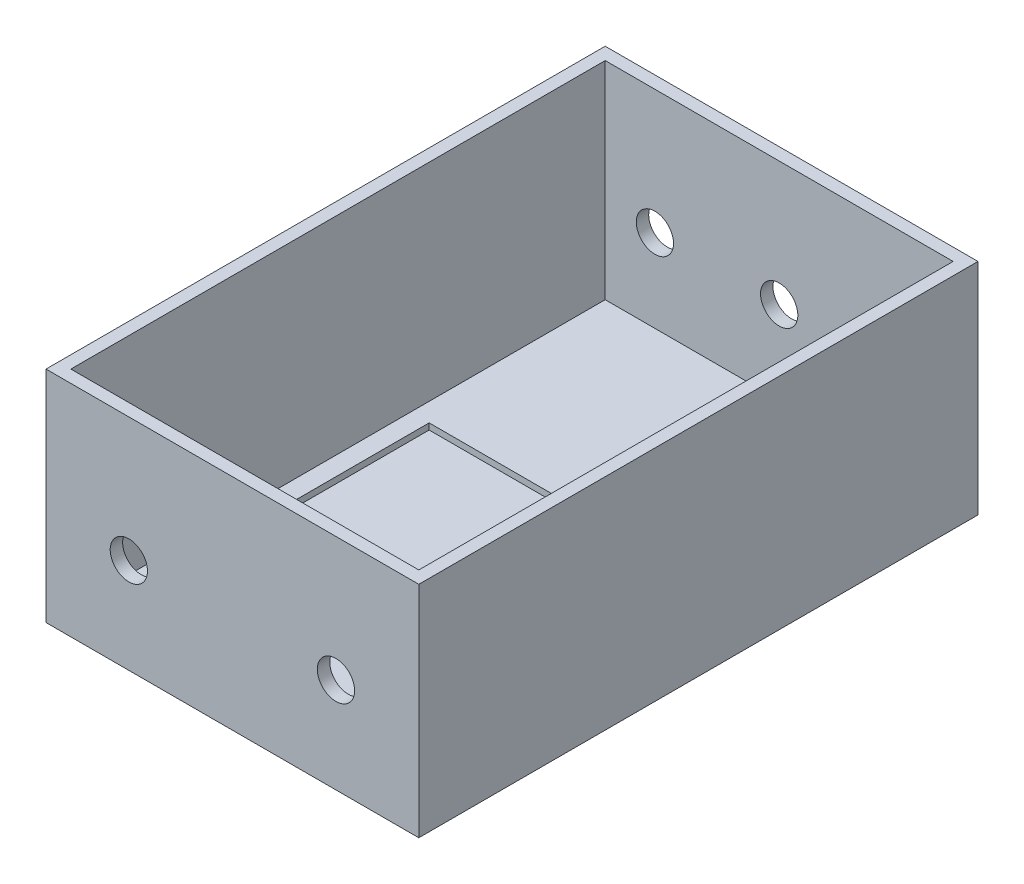
from build123d import *

# Parameters (mm, degrees)
SKETCH1_W           = 90
SKETCH1_H           = 135
BOSS_EXTRUDE1_DEPTH = 3
SKETCH2_W           = 75
SKETCH2_H           = 35
CUT_EXTRUDE1_DEPTH  = 1.5
SKETCH3_W           = 90
SKETCH3_H           = 135
SKETCH3_W_2         = 84
SKETCH3_H_2         = 129
BOSS_EXTRUDE2_DEPTH = 50
SKETCH4_R           = 4.5
CUT_EXTRUDE2_DEPTH  = 3
SKETCH5_R           = 4.5
CUT_EXTRUDE3_DEPTH  = 3


with BuildPart() as part:
    # Sketch1 → Boss-Extrude1 (new body)
    with BuildSketch(Plane(origin=(0, 0, 0), x_dir=(1, 0, 0), z_dir=(0, 1, 0))):
        Rectangle(SKETCH1_W, SKETCH1_H)
    extrude(amount=BOSS_EXTRUDE1_DEPTH)

    # Sketch2 → Cut-Extrude1 (cut)
    with BuildSketch(Plane(origin=(0, 3, 0), x_dir=(1, 0, 0), z_dir=(0, 1, 0))):
        Rectangle(SKETCH2_W, SKETCH2_H)
    extrude(amount=-CUT_EXTRUDE1_DEPTH, mode=Mode.SUBTRACT)

    # Sketch3 → Boss-Extrude2 (add)
    with BuildSketch(Plane(origin=(0, 3, 0), x_dir=(1, 0, 0), z_dir=(0, 1, 0))):
        Rectangle(SKETCH3_W, SKETCH3_H)
        Rectangle(SKETCH3_W_2, SKETCH3_H_2, mode=Mode.SUBTRACT)
    extrude(amount=BOSS_EXTRUDE2_DEPTH)

    # Sketch4 → Cut-Extrude2 (cut)
    with BuildSketch(Plane.XY.offset(67.5)):
        with Locations((-25, 23)):
            Circle(SKETCH4_R)
        with Locations((25, 23)):
            Circle(SKETCH4_R)
    extrude(amount=-CUT_EXTRUDE2_DEPTH, mode=Mode.SUBTRACT)

    # Sketch5 → Cut-Extrude3 (cut)
    with BuildSketch(Plane(origin=(0, 0, -67.5), x_dir=(-1, 0, 0), z_dir=(0, 0, -1))):
        with Locations((-30, 23)):
            Circle(SKETCH5_R)
        with Locations((0, 23)):
            Circle(SKETCH5_R)
        with Locations((30, 23)):
            Circle(SKETCH5_R)
    extrude(amount=-CUT_EXTRUDE3_DEPTH, mode=Mode.SUBTRACT)


solid = part.part
